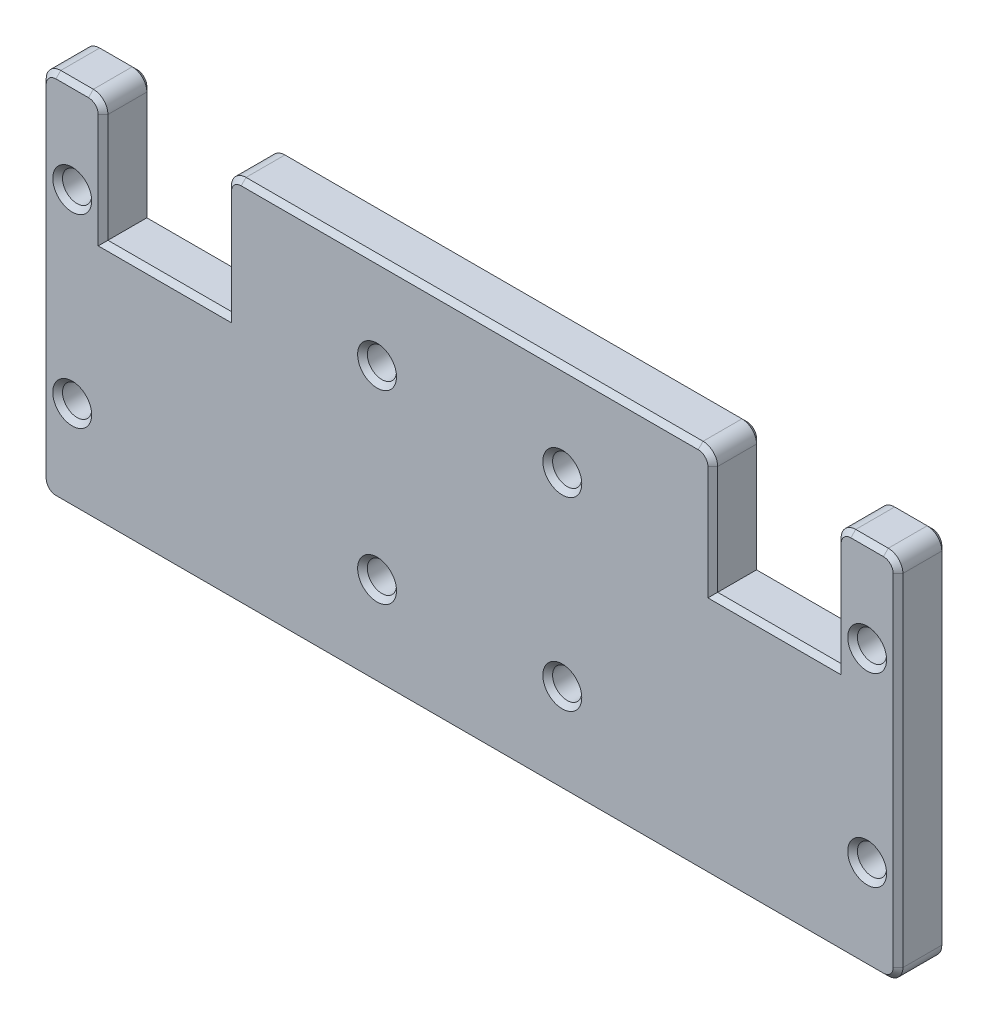
from build123d import *

# Parameters (mm, degrees)
SKETCH1_R           = 3
BOSS_EXTRUDE1_DEPTH = 10
CHAMFER1_SIZE       = 1


with BuildPart() as part:
    # Sketch1 → Boss-Extrude1 (new body)
    with BuildSketch(Plane.XY):
        with BuildLine():
            Line((75.4, 25.4), (50, 25.4))
            Line((50, 25.4), (50, 47.8))
            ThreePointArc((50, 47.8), (49.121320344, 49.921320344), (47, 50.8))
            Line((47, 50.8), (-47, 50.8))
            ThreePointArc((-47, 50.8), (-49.121320344, 49.921320344), (-50, 47.8))
            Line((-50, 47.8), (-50, 25.4))
            Line((-50, 25.4), (-75.4, 25.4))
            Line((-75.4, 25.4), (-75.4, 47.8))
            ThreePointArc((-75.4, 47.8), (-76.278679656, 49.921320344), (-78.4, 50.8))
            Line((-78.4, 50.8), (-85.1, 50.8))
            ThreePointArc((-85.1, 50.8), (-87.221320344, 49.921320344), (-88.1, 47.8))
            Line((-88.1, 47.8), (-88.1, -22.4))
            ThreePointArc((-88.1, -22.4), (-87.221320344, -24.521320344), (-85.1, -25.4))
            Line((-85.1, -25.4), (85.1, -25.4))
            ThreePointArc((85.1, -25.4), (87.221320344, -24.521320344), (88.1, -22.4))
            Line((88.1, -22.4), (88.1, 47.8))
            ThreePointArc((88.1, 47.8), (87.221320344, 49.921320344), (85.1, 50.8))
            Line((85.1, 50.8), (78.4, 50.8))
            ThreePointArc((78.4, 50.8), (76.278679656, 49.921320344), (75.4, 47.8))
            Line((75.4, 47.8), (75.4, 25.4))
        make_face()
        with Locations((-19.05, 31.75)):
            Circle(SKETCH1_R, mode=Mode.SUBTRACT)
        with Locations((19.05, 31.75)):
            Circle(SKETCH1_R, mode=Mode.SUBTRACT)
        with Locations((19.05, -6.35)):
            Circle(SKETCH1_R, mode=Mode.SUBTRACT)
        with Locations((-19.05, -6.35)):
            Circle(SKETCH1_R, mode=Mode.SUBTRACT)
        with Locations((-81.75, 31.75)):
            Circle(SKETCH1_R, mode=Mode.SUBTRACT)
        with Locations((-81.75, -6.35)):
            Circle(SKETCH1_R, mode=Mode.SUBTRACT)
        with Locations(Location((81.75, -6.35, 0), (0, 0, 180))):
            Circle(SKETCH1_R, mode=Mode.SUBTRACT)
        with Locations(Location((81.75, 31.75, 0), (0, 0, 180))):
            Circle(SKETCH1_R, mode=Mode.SUBTRACT)
    extrude(amount=BOSS_EXTRUDE1_DEPTH)

    # Chamfer1
    chamfer1_edges = [part.edges().sort_by_distance(p)[0] for p in [
        (-81.75, 50.8, 10),
        (-87.221320344, 49.921320344, 10),
        (-62.7, 25.4, 0),
        (-50, 36.6, 0),
        (-49.121320344, 49.921320344, 0),
        (0, 50.8, 0),
        (-88.1, 12.7, 10),
        (49.121320344, 49.921320344, 0),
        (50, 36.6, 0),
        (62.7, 25.4, 0),
        (75.4, 36.6, 0),
        (76.278679656, 49.921320344, 0),
        (81.75, 50.8, 0),
        (87.221320344, 49.921320344, 0),
        (88.1, 12.7, 0),
        (87.221320344, -24.521320344, 0),
        (0, -25.4, 0),
        (-87.221320344, -24.521320344, 10),
        (-87.221320344, -24.521320344, 0),
        (-88.1, 12.7, 0),
        (-87.221320344, 49.921320344, 0),
        (-81.75, 50.8, 0),
        (-76.278679656, 49.921320344, 0),
        (-75.4, 36.6, 0),
        (0, -25.4, 10),
        (87.221320344, -24.521320344, 10),
        (88.1, 12.7, 10),
        (87.221320344, 49.921320344, 10),
        (81.75, 50.8, 10),
        (76.278679656, 49.921320344, 10),
        (-22.05, 31.75, 0),
        (-22.05, 31.75, 10),
        (-75.4, 36.6, 10),
        (75.4, 36.6, 10),
        (-84.75, 31.75, 0),
        (-84.75, 31.75, 10),
        (16.05, 31.75, 0),
        (62.7, 25.4, 10),
        (16.05, 31.75, 10),
        (16.05, -6.35, 0),
        (50, 36.6, 10),
        (16.05, -6.35, 10),
        (-22.05, -6.35, 0),
        (-22.05, -6.35, 10),
        (49.121320344, 49.921320344, 10),
        (-84.75, -6.35, 0),
        (-84.75, -6.35, 10),
        (0, 50.8, 10),
        (84.75, -6.35, 0),
        (84.75, -6.35, 10),
        (-49.121320344, 49.921320344, 10),
        (84.75, 31.75, 0),
        (84.75, 31.75, 10),
        (-50, 36.6, 10),
        (-62.7, 25.4, 10),
        (-76.278679656, 49.921320344, 10),
    ]]
    chamfer(chamfer1_edges, length=CHAMFER1_SIZE)


solid = part.part
